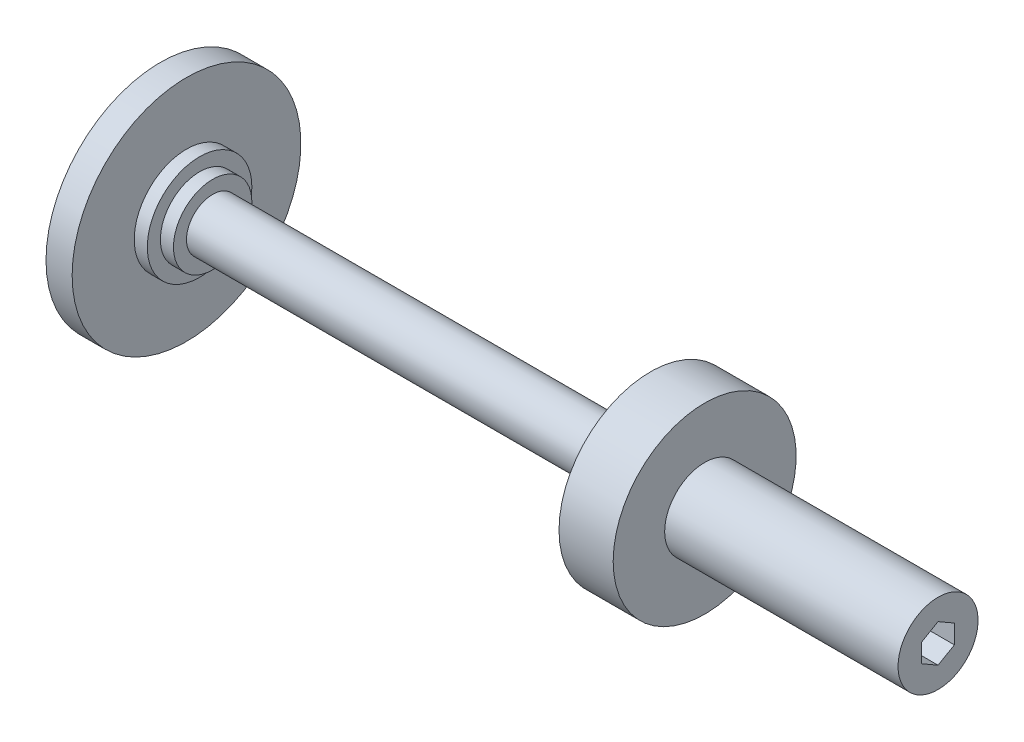
from build123d import *

# Parameters (mm, degrees)
SKETCH2_R           = 12.7
BOSS_EXTRUDE1_DEPTH = 254
BOSS_EXTRUDE2_START = -15.875
SKETCH4_R           = 55.5625
SKETCH4_R_2         = 12.7
BOSS_EXTRUDE2_DEPTH = 12.7
CUT_EXTRUDE1_DEPTH  = 63.5


with BuildPart() as part:
    # Sketch1 → Revolve_Chuck (revolve)
    with BuildSketch(Plane.XY, mode=Mode.PRIVATE) as revolve_chuck_sk:
        Polygon((139.7, 0), (139.7, 19.4437), (26.3144, 19.4437), (26.3144, 44.45), (0, 44.45), (0, 0), align=None)
    revolve(revolve_chuck_sk.sketch.rotate(Axis((0, 0, 0), (1, 0, 0)), 90), axis=Axis((0, 0, 0), (1, 0, 0)))

    # Sketch2 → Boss-Extrude1 (add)
    with BuildSketch(Plane.ZY):
        Circle(SKETCH2_R)
    extrude(amount=BOSS_EXTRUDE1_DEPTH)

    # Sketch5 → Cut-Extrude1 (cut)
    with BuildSketch(Plane(origin=(139.7, 0, 0), x_dir=(0, 0, -1), z_dir=(1, 0, 0))):
        Polygon((0, 9.165435523), (-7.9375, 4.582717762), (-7.9375, -4.582717762), (0, -9.165435523), (7.9375, -4.582717762), (7.9375, 4.582717762), align=None)
    extrude(amount=-CUT_EXTRUDE1_DEPTH, mode=Mode.SUBTRACT)


with BuildPart() as body_2:
    # Sketch4 → Boss-Extrude2 (new body)
    with BuildSketch(Plane.ZY.offset(254).offset(BOSS_EXTRUDE2_START)):
        Circle(SKETCH4_R)
        Circle(SKETCH4_R_2, mode=Mode.SUBTRACT)
    extrude(amount=-BOSS_EXTRUDE2_DEPTH)


with BuildPart() as body_3:
    # Sketch6 → Revolve1 (revolve)
    with BuildSketch(Plane.XY, mode=Mode.PRIVATE) as revolve1_sk:
        Polygon((-238.125, 12.7), (-238.125, 25.4), (-244.475, 25.4), (-244.475, 19.05), (-250.825, 19.05), (-250.825, 12.7), align=None)
        Polygon((-212.725, 12.7), (-225.425, 12.7), (-225.425, 25.4), (-219.075, 25.4), (-219.075, 19.05), (-212.725, 19.05), align=None)
    revolve(revolve1_sk.sketch.rotate(Axis((-254, 0, 0), (-1, 0, 0)), 90), axis=Axis((-254, 0, 0), (-1, 0, 0)))


solid = Compound([part.part, body_2.part, body_3.part])
